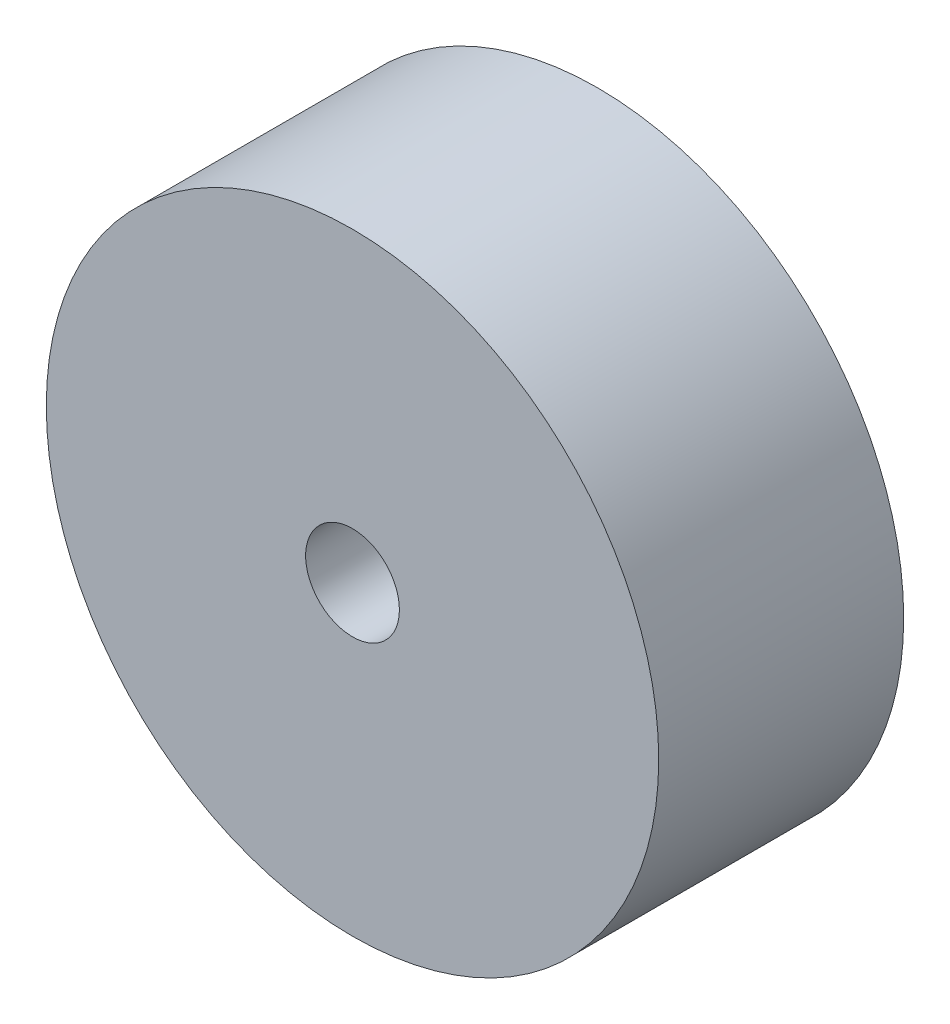
from build123d import *

# Parameters (mm, degrees)
SKETCH1_R           = 7.25
BOSS_EXTRUDE1_DEPTH = 5.8
SKETCH2_R           = 6.325
CUT_EXTRUDE1_DEPTH  = 1.5875
SKETCH3_R           = 1
BOSS_EXTRUDE2_DEPTH = 1.5875
SKETCH4_R           = 3.15
BOSS_EXTRUDE3_DEPTH = 3
SKETCH5_R           = 0.85
CUT_EXTRUDE2_DEPTH  = 38.866125059
SKETCH6_R           = 1.11
CUT_EXTRUDE3_DEPTH  = 3


with BuildPart() as part:
    # Sketch1 → Boss-Extrude1 (new body)
    with BuildSketch(Plane.XY):
        with Locations((-29.082250471, -1.703826149)):
            Circle(SKETCH1_R)
    extrude(amount=BOSS_EXTRUDE1_DEPTH)

    # Sketch2 → Cut-Extrude1 (cut)
    with BuildSketch(Plane(origin=(0, 0, 0), x_dir=(-1, 0, 0), z_dir=(0, 0, -1))):
        with Locations((29.082250471, -1.703826149)):
            Circle(SKETCH2_R)
    extrude(amount=-CUT_EXTRUDE1_DEPTH, mode=Mode.SUBTRACT)

    # Sketch3 → Boss-Extrude2 (add)
    with BuildSketch(Plane(origin=(0, 0, 1.5875), x_dir=(-1, 0, 0), z_dir=(0, 0, -1))):
        with Locations((29.082250471, -1.703826149)):
            Circle(SKETCH3_R)
    extrude(amount=BOSS_EXTRUDE2_DEPTH)

    # Sketch4 → Boss-Extrude3 (add)
    with BuildSketch(Plane(origin=(0, 0, 0), x_dir=(-1, 0, 0), z_dir=(0, 0, -1))):
        with Locations((29.082250471, -1.703826149)):
            Circle(SKETCH4_R)
    extrude(amount=-BOSS_EXTRUDE3_DEPTH)

    # Sketch5 → Cut-Extrude2 (cut, through all)
    with BuildSketch(Plane(origin=(0, 0, 0), x_dir=(-1, 0, 0), z_dir=(0, 0, -1))):
        with Locations((29.082250471, -1.703826149)):
            Circle(SKETCH5_R)
    extrude(amount=-CUT_EXTRUDE2_DEPTH, mode=Mode.SUBTRACT)

    # Sketch6 → Cut-Extrude3 (cut)
    with BuildSketch(Plane.XY.offset(5.8)):
        with Locations((-29.082250471, -1.703826149)):
            Circle(SKETCH6_R)
    extrude(amount=-CUT_EXTRUDE3_DEPTH, mode=Mode.SUBTRACT)


solid = part.part
